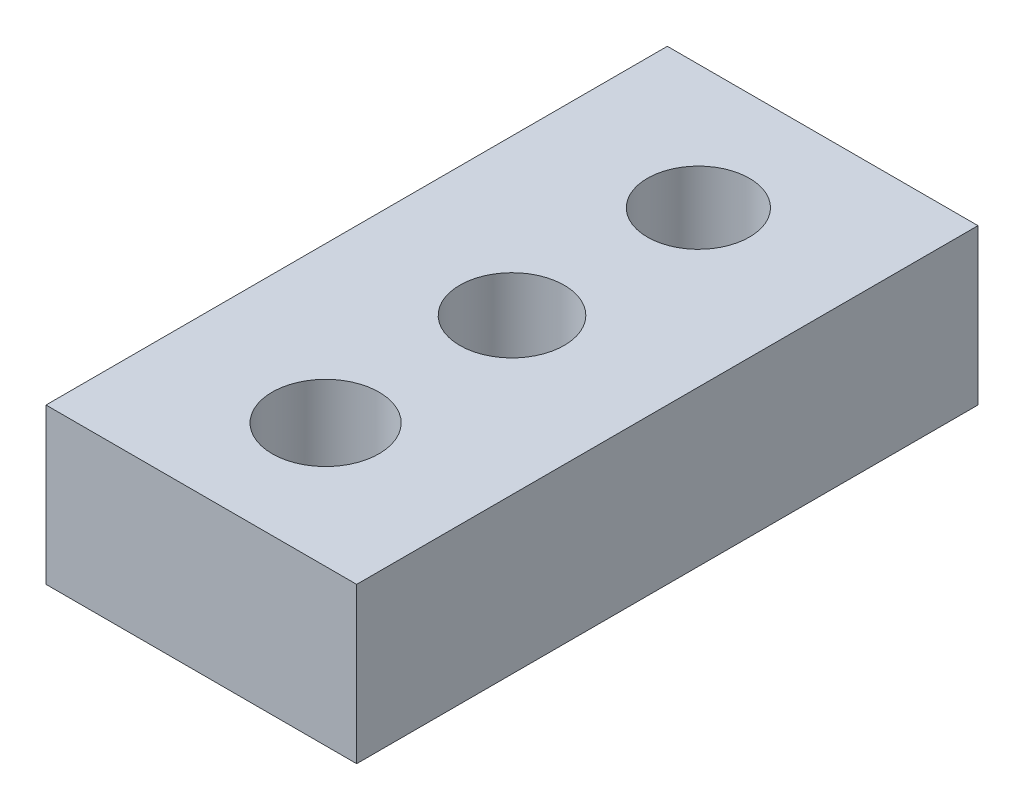
from build123d import *

# Parameters (mm, degrees)
SKETCH1_W                   = 12.7
SKETCH1_H                   = 25.4
BOSS_EXTRUDE1_DEPTH         = 6.35
F_1_0_MM_DOWEL_HOLES1_D     = 4.17
F_1_0_MM_DOWEL_HOLES1_DEPTH = 7.874
F_1_0_MM_DOWEL_HOLES1_TIP   = 1.252794391
F_1_0_MM_DOWEL_HOLES2_D     = 4.27
F_1_0_MM_DOWEL_HOLES2_DEPTH = 7.874
F_1_0_MM_DOWEL_HOLES2_TIP   = 1.282837422
F_1_0_MM_DOWEL_HOLES3_D     = 4.37
F_1_0_MM_DOWEL_HOLES3_DEPTH = 7.874
F_1_0_MM_DOWEL_HOLES3_TIP   = 1.312880453


with BuildPart() as part:
    # Sketch1 → Boss-Extrude1 (new body)
    with BuildSketch(Plane(origin=(0, 0, 0), x_dir=(1, 0, 0), z_dir=(0, 1, 0))):
        Rectangle(SKETCH1_W, SKETCH1_H)
    extrude(amount=BOSS_EXTRUDE1_DEPTH)

    # Ø1.0 mm Dowel Holes1
    with Locations(Plane(origin=(0, 6.35, 0), x_dir=(1, 0, 0), z_dir=(0, 1, 0))):
        with Locations((0, 7.62)):
            Hole(F_1_0_MM_DOWEL_HOLES1_D / 2, depth=F_1_0_MM_DOWEL_HOLES1_DEPTH)
            with Locations((0, 0, -(F_1_0_MM_DOWEL_HOLES1_DEPTH + F_1_0_MM_DOWEL_HOLES1_TIP / 2))):  # 118° drill point
                Cone(0, F_1_0_MM_DOWEL_HOLES1_D / 2, F_1_0_MM_DOWEL_HOLES1_TIP, mode=Mode.SUBTRACT)

    # Ø1.0 mm Dowel Holes2
    with Locations(Plane(origin=(0, 6.35, 0), x_dir=(1, 0, 0), z_dir=(0, 1, 0))):
        with Locations((0, 0)):
            Hole(F_1_0_MM_DOWEL_HOLES2_D / 2, depth=F_1_0_MM_DOWEL_HOLES2_DEPTH)
            with Locations((0, 0, -(F_1_0_MM_DOWEL_HOLES2_DEPTH + F_1_0_MM_DOWEL_HOLES2_TIP / 2))):  # 118° drill point
                Cone(0, F_1_0_MM_DOWEL_HOLES2_D / 2, F_1_0_MM_DOWEL_HOLES2_TIP, mode=Mode.SUBTRACT)

    # Ø1.0 mm Dowel Holes3
    with Locations(Plane(origin=(0, 6.35, 0), x_dir=(1, 0, 0), z_dir=(0, 1, 0))):
        with Locations((0, -7.62)):
            Hole(F_1_0_MM_DOWEL_HOLES3_D / 2, depth=F_1_0_MM_DOWEL_HOLES3_DEPTH)
            with Locations((0, 0, -(F_1_0_MM_DOWEL_HOLES3_DEPTH + F_1_0_MM_DOWEL_HOLES3_TIP / 2))):  # 118° drill point
                Cone(0, F_1_0_MM_DOWEL_HOLES3_D / 2, F_1_0_MM_DOWEL_HOLES3_TIP, mode=Mode.SUBTRACT)


solid = part.part
